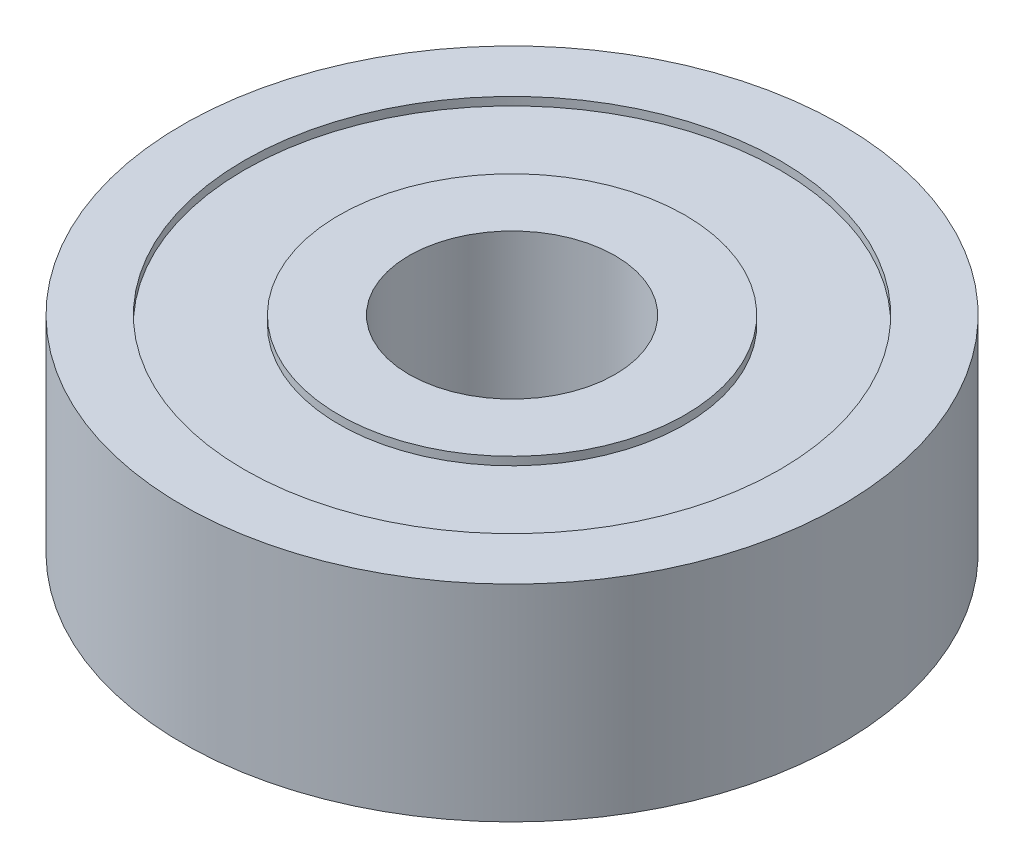
from build123d import *


with BuildPart() as part:
    # Croquis1 → Revolución1 (revolve)
    with BuildSketch(Plane.XY, mode=Mode.PRIVATE) as revoluci_n1_sk:
        Polygon((2.5, -2.5), (2.5, 2.5), (4.2, 2.5), (4.2, 2.3), (6.5, 2.3), (6.5, 2.5), (8, 2.5), (8, -2.5), (6.5, -2.5), (6.5, -2.3), (4.2, -2.3), (4.2, -2.5), align=None)
    revolve(revoluci_n1_sk.sketch.rotate(Axis((0, -2.5, 0), (0, 1, 0)), 90), axis=Axis((0, -2.5, 0), (0, 1, 0)))


solid = part.part
